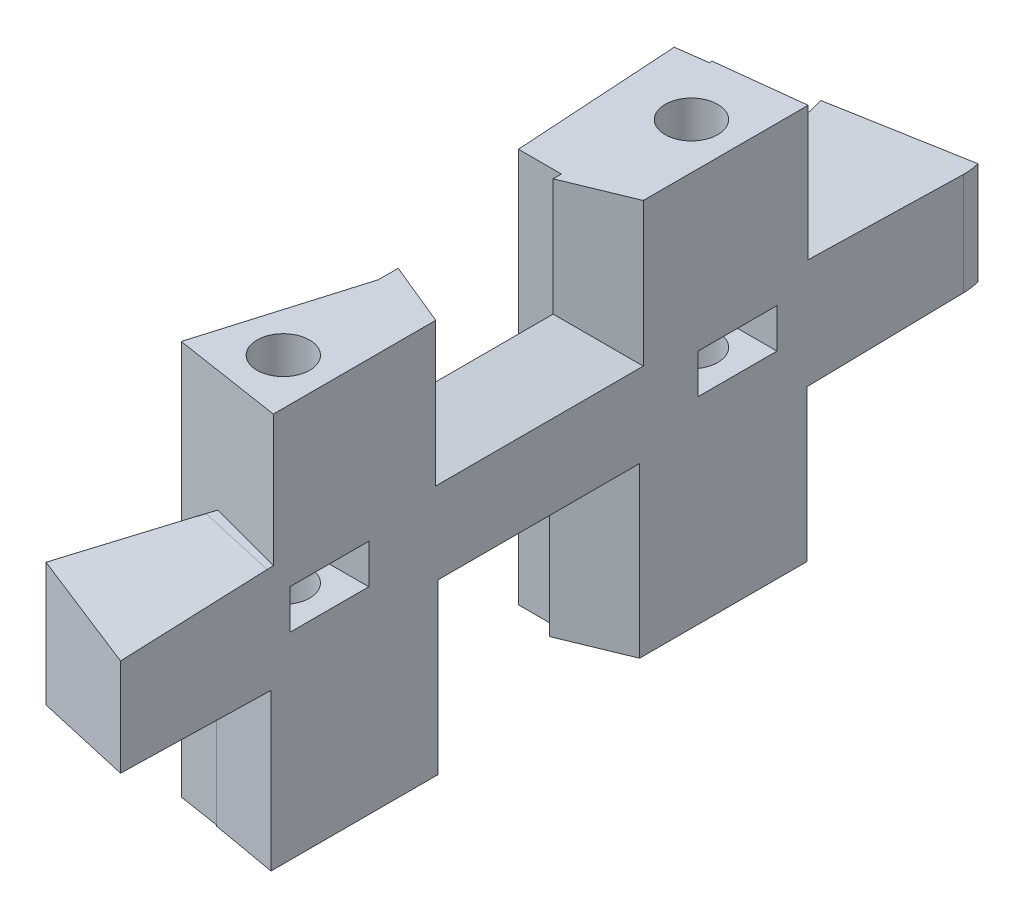
from build123d import *

# Parameters (mm, degrees)
SKETCH_2_W               = 27
SKETCH_2_H               = 75
EXTRUDE_1_DEPTH          = 30
FILLET_1_R               = 5
CUT_EXTRUDE_1_DEPTH      = 10
CUT_EXTRUDE_1_DEPTH_BACK = 62.976777909
SKETCH_3_W               = 12.003584996
SKETCH_3_H               = 8.623265084
SKETCH_3_W_2             = 13.38824361
SKETCH_3_H_2             = 10.855989936
CUT_EXTRUDE_2_DEPTH      = 56.093103017
CUT_EXTRUDE_2_DEPTH_BACK = 56.093103017
SKETCH_4_W               = 11.777688934
SKETCH_4_H               = 8.406294685
SKETCH_4_W_2             = 11.330835953
SKETCH_4_H_2             = 19.308390714
CUT_EXTRUDE_3_DEPTH      = 10
CUT_EXTRUDE_3_DEPTH_BACK = 62.976777909
SKETCH_5_W               = 10.454752522
SKETCH_5_H               = 7.917134022
SKETCH_5_W_2             = 10.247562273
SKETCH_5_H_2             = 14.675567582
CUT_EXTRUDE_4_DEPTH      = 51.311529494
CUT_EXTRUDE_5_DEPTH      = 1
CUT_EXTRUDE_6_DEPTH      = 56.093103188
CUT_EXTRUDE_6_DEPTH_BACK = 56.093103188
CUT_EXTRUDE_7_DEPTH      = 56.093103188
CUT_EXTRUDE_7_DEPTH_BACK = 56.093103188
SKETCH_28_R              = 2
CUT_EXTRUDE_8_DEPTH      = 53.794412747
CUT_EXTRUDE_9_DEPTH      = 51.311529658
SKETCH_30_W              = 10.059160286
SKETCH_30_H              = 37.902915959
SKETCH_30_W_2            = 15.489849721
SKETCH_30_H_2            = 38.902668553
CUT_EXTRUDE_10_DEPTH     = 51.038113138
SKETCH_31_W              = 8.737975265
SKETCH_31_H              = 34.755902135
SKETCH_31_W_2            = 10.96580713
CUT_EXTRUDE_11_DEPTH     = 49.583503796
CUT_EXTRUDE_12_DEPTH     = 50.524399755
CUT_EXTRUDE_13_DEPTH     = 48.916784232
SKETCH_35_W              = 30.266892165
SKETCH_35_H              = 64.418514712
CUT_EXTRUDE_14_DEPTH     = 49.293556396
SKETCH_36_W              = 14.582556354
SKETCH_36_H              = 32.207236855
CUT_EXTRUDE_15_DEPTH     = 49.026638847
CUT_EXTRUDE_16_DEPTH     = 47.743690696
CUT_EXTRUDE_17_DEPTH     = 47.743690696
CUT_EXTRUDE_19_DEPTH     = 9.2
CUT_EXTRUDE_20_REACH     = 64.237
CUT_EXTRUDE_21_REACH     = 48.744
SKETCH_41_W              = 6
SKETCH_41_H              = 3


with BuildPart() as part:
    # 草图2 → 凸台-拉伸1 (new body)
    with BuildSketch(Plane(origin=(0, 0, 0), x_dir=(1, 0, 0), z_dir=(0, 1, 0))):
        with Locations((-1.5, 0)):
            Rectangle(SKETCH_2_W, SKETCH_2_H)
    extrude(amount=EXTRUDE_1_DEPTH)

    # 圆角1
    fillet_1_edges = [part.edges().sort_by_distance(p)[0] for p in [
        (12, 15, -37.5),
        (12, 15, 37.5),
    ]]
    fillet(fillet_1_edges, radius=FILLET_1_R)

    # 草图3 → 切除-拉伸1 (cut, two sides: drawn at the far end of the back side and taken through both)
    with BuildSketch(Plane(origin=(18.680874692, 0, -5.005525288), x_dir=(-0.2588190451025125, 0, -0.9659258262890705), z_dir=(0.9659258262890705, 0, -0.2588190451025125)).offset(-CUT_EXTRUDE_1_DEPTH_BACK)):
        with Locations((24.234815862, 24.978507534)):
            Rectangle(SKETCH_3_W, SKETCH_3_H)
        with Locations((24.671178169, 5.427994968)):
            Rectangle(SKETCH_3_W_2, SKETCH_3_H_2)
    extrude(amount=CUT_EXTRUDE_1_DEPTH + CUT_EXTRUDE_1_DEPTH_BACK, mode=Mode.SUBTRACT)

    # 草图4 → 切除-拉伸2 (cut, two sides: drawn at the far end of the back side and taken through both)
    with BuildSketch(Plane(origin=(12, 0, 0), x_dir=(0, 0, -1), z_dir=(1, 0, 0)).offset(-CUT_EXTRUDE_2_DEPTH_BACK)):
        with Locations((0.274688021, 25.296852658)):
            Rectangle(SKETCH_4_W, SKETCH_4_H)
        with Locations((0.220425577, 1.167429902)):
            Rectangle(SKETCH_4_W_2, SKETCH_4_H_2)
    extrude(amount=CUT_EXTRUDE_2_DEPTH + CUT_EXTRUDE_2_DEPTH_BACK, mode=Mode.SUBTRACT)

    # 草图5 → 切除-拉伸3 (cut, two sides: drawn at the far end of the back side and taken through both)
    with BuildSketch(Plane(origin=(18.680874692, 0, 5.005525288), x_dir=(0.25881904510251236, 0, -0.9659258262890705), z_dir=(0.9659258262890706, 0, 0.25881904510251236)).offset(-CUT_EXTRUDE_3_DEPTH_BACK)):
        with Locations((-23.173403852, 25.272433697)):
            Rectangle(SKETCH_5_W, SKETCH_5_H)
        with Locations((-23.069808728, 2.959186052)):
            Rectangle(SKETCH_5_W_2, SKETCH_5_H_2)
    extrude(amount=CUT_EXTRUDE_3_DEPTH + CUT_EXTRUDE_3_DEPTH_BACK, mode=Mode.SUBTRACT)

    # 草图6 → 切除-拉伸4 (cut, through all)
    with BuildSketch(Plane.XZ):
        Polygon((7.146107594, 7.129038799), (3.725036618, 18.666143782), (-0.059848724, 31.430164127), (-15, 28.234595706), (-15, -49.974737356), (-6.027187149, -52.37103324), (-0.374019248, -31.203022256), (3.096542815, -19.264972049), (3.878697096, -6.795389704), (7.146107594, -6.795389704), align=None)
    extrude(amount=-CUT_EXTRUDE_4_DEPTH, mode=Mode.SUBTRACT)

    # 草图9 → 切除-放样2 section 0
    with BuildSketch(Plane(origin=(20.612726345, 0, -5.523163378), x_dir=(-0.2588190451025125, 0, -0.9659258262890705), z_dir=(0.9659258262890705, 0, -0.2588190451025125))):
        with BuildLine():
            Line((30.994329497, 19.422837815), (16.233023364, 19.422837815))
            Line((16.233023364, 19.422837815), (16.233023364, 30))
            Line((16.233023364, 30), (30.994329497, 30))
            Line((30.994329497, 30), (30.994329497, 19.422837815))
        make_face()
    # 草图8 → 切除-放样2 section 1
    with BuildSketch(Plane(origin=(8.019388794, 0, -2.331351103), x_dir=(-0.27915709503779457, 0, -0.9602454458574953), z_dir=(0.9602454458574953, 0, -0.27915709503779457))):
        with BuildLine():
            Line((30.066970145, 29.290140076), (18.060708335, 29.290140076))
            Line((18.060708335, 29.290140076), (18.060708335, 20.666874992))
            Line((18.060708335, 20.666874992), (30.066970145, 20.666874992))
            Line((30.066970145, 20.666874992), (30.066970145, 29.290140076))
        make_face()
    loft(mode=Mode.SUBTRACT)

    # 草图12 → 切除-放样4 section 0
    with BuildSketch(Plane(origin=(8.019388794, 0, -2.331351103), x_dir=(-0.27915709503779457, 0, -0.9602454458574953), z_dir=(0.9602454458574953, 0, -0.27915709503779457))):
        with BuildLine():
            Line((31.19539038, 0), (31.19539038, 10.855989936))
            Line((31.19539038, 10.855989936), (30.066970145, 10.855989936))
            Line((30.066970145, 10.855989936), (17.804684254, 10.855989936))
            Line((17.804684254, 10.855989936), (17.804684254, 0))
            Line((17.804684254, 0), (31.19539038, 0))
        make_face()
    # 草图11 → 切除-放样4 section 1
    with BuildSketch(Plane(origin=(20.612726345, 0, -5.523163378), x_dir=(-0.2588190451025125, 0, -0.9659258262890705), z_dir=(0.9659258262890705, 0, -0.2588190451025125))):
        with BuildLine():
            Line((16.233023364, 11.839832351), (31.553216936, 11.839832351))
            Line((31.553216936, 11.839832351), (31.553216936, 0))
            Line((31.553216936, 0), (16.233023364, 0))
            Line((16.233023364, 0), (16.233023364, 11.839832351))
        make_face()
    loft(mode=Mode.SUBTRACT)

    # 草图16 → 切除-放样5 section 0
    with BuildSketch(Plane(origin=(12, 0, 0), x_dir=(0, 0, -1), z_dir=(1, 0, 0))):
        with BuildLine():
            Line((-7.444992399, 12.821625259), (7.885843554, 12.821625259))
            Line((7.885843554, 12.821625259), (7.885843554, 0))
            Line((7.885843554, 0), (-7.444992399, 0))
            Line((-7.444992399, 0), (-7.444992399, 12.821625259))
        make_face()
    # 草图15 → 切除-放样5 section 1
    with BuildSketch(Plane.ZY.offset(-7.146107594)):
        with BuildLine():
            Line((5.444992399, 0), (5.444992399, 10.821625259))
            Line((5.444992399, 10.821625259), (-5.885843554, 10.821625259))
            Line((-5.885843554, 10.821625259), (-5.885843554, 0))
            Line((-5.885843554, 0), (5.444992399, 0))
        make_face()
    loft(mode=Mode.SUBTRACT)

    # 草图18 → 切除-放样6 section 0
    with BuildSketch(Plane(origin=(12, 0, 0), x_dir=(0, 0, -1), z_dir=(1, 0, 0))):
        with BuildLine():
            Line((8.163532488, 19.093705315), (-7.614156446, 19.093705315))
            Line((-7.614156446, 19.093705315), (-7.614156446, 30))
            Line((-7.614156446, 30), (8.163532488, 30))
            Line((8.163532488, 30), (8.163532488, 19.093705315))
        make_face()
    # 草图17 → 切除-放样6 section 1
    with BuildSketch(Plane.ZY.offset(-7.146107594)):
        with BuildLine():
            Line((5.614156446, 29.5), (-6.163532488, 29.5))
            Line((-6.163532488, 29.5), (-6.163532488, 21.093705315))
            Line((-6.163532488, 21.093705315), (5.614156446, 21.093705315))
            Line((5.614156446, 21.093705315), (5.614156446, 29.5))
        make_face()
    loft(mode=Mode.SUBTRACT)

    # 草图20 → 切除-放样7 section 0
    with BuildSketch(Plane(origin=(8.511647159, 0, 2.523938986), x_dir=(-0.28429225609974595, 0, 0.9587376664769757), z_dir=(-0.9587376664769756, 0, -0.2842922560997459))):
        with BuildLine():
            Line((28.175687949, 29.231000708), (28.175687949, 21.313866686))
            Line((28.175687949, 21.313866686), (17.717272084, 21.313866686))
            Line((17.717272084, 21.313866686), (17.717272084, 29.231000708))
            Line((17.717272084, 29.231000708), (28.175687949, 29.231000708))
        make_face()
    # 草图19 → 切除-放样7 section 1
    with BuildSketch(Plane(origin=(20.612726345, 0, 5.523163378), x_dir=(0.25881904510251236, 0, -0.9659258262890705), z_dir=(0.9659258262890706, 0, 0.25881904510251236))):
        with BuildLine():
            Line((-30.400780113, 30), (-15.946027591, 30))
            Line((-15.946027591, 30), (-15.946027591, 19.313866686))
            Line((-15.946027591, 19.313866686), (-30.400780113, 19.313866686))
            Line((-30.400780113, 19.313866686), (-30.400780113, 30))
        make_face()
    loft(mode=Mode.SUBTRACT)

    # 草图23 → 切除-放样8 section 0
    with BuildSketch(Plane(origin=(8.511647159, 0, 2.523938986), x_dir=(-0.28429225609974595, 0, 0.9587376664769757), z_dir=(-0.9587376664769756, 0, -0.2842922560997459))):
        with BuildLine():
            Line((16.852369456, 0), (28.787602444, 0))
            Line((28.787602444, 0), (28.787602444, 11.157572741))
            Line((28.787602444, 11.157572741), (16.852369456, 11.157572741))
            Line((16.852369456, 11.157572741), (16.852369456, 0))
        make_face()
    # 草图21 → 切除-放样8 section 1
    with BuildSketch(Plane(origin=(20.612726345, 0, 5.523163378), x_dir=(0.25881904510251236, 0, -0.9659258262890705), z_dir=(0.9659258262890706, 0, 0.25881904510251236))):
        with BuildLine():
            Line((-30.286760813, 12.296969843), (-15.946027591, 12.296969843))
            Line((-15.946027591, 12.296969843), (-15.946027591, 0))
            Line((-15.946027591, 0), (-30.286760813, 0))
            Line((-30.286760813, 0), (-30.286760813, 12.296969843))
        make_face()
    loft(mode=Mode.SUBTRACT)

    # 草图25 → 切除-拉伸5 (cut)
    with BuildSketch(Plane(origin=(0, 30, 0), x_dir=(1, 0, 0), z_dir=(0, 1, 0))):
        with BuildLine():
            Line((0.501517264, -29.537032302), (11.625363064, -34.398951428))
            ThreePointArc((11.625363064, -34.398951428), (11.905446734, -33.46777701), (12, -32.5))
            Line((12, -32.5), (12, -20.437772986))
            Line((12, -20.437772986), (3.474763906, -19.51015508))
            Line((3.474763906, -19.51015508), (0.501517264, -29.537032302))
        make_face()
        with BuildLine():
            Line((12, 20.700973532), (2.977613921, 19.674064031))
            Line((2.977613921, 19.674064031), (-0.374019248, 31.203022256))
            Line((-0.374019248, 31.203022256), (11.306961147, 35.039701887))
            ThreePointArc((11.306961147, 35.039701887), (11.823629636, 33.816281555), (12, 32.5))
            Line((12, 32.5), (12, 20.700973532))
        make_face()
        Polygon((7.146107594, 6.163532488), (12, 8.163532488), (12, -7.614156446), (7.146107594, -5.614156446), align=None)
    extrude(amount=-CUT_EXTRUDE_5_DEPTH, mode=Mode.SUBTRACT)

    # 草图26 → 切除-拉伸6 (cut, two sides: drawn at the far end of the back side and taken through both)
    with BuildSketch(Plane(origin=(12, 0, 0), x_dir=(0, 0, -1), z_dir=(1, 0, 0)).offset(-CUT_EXTRUDE_6_DEPTH_BACK)):
        with BuildLine():
            Line((-37.5, 3.256499349), (-43.423283477, 4.717056112))
            Line((-43.423283477, 4.717056112), (-37.5, 28.189374855))
            ThreePointArc((-37.5, 28.189374855), (-35.985697907, 15.722937102), (-37.5, 3.256499349))
        make_face()
    extrude(amount=CUT_EXTRUDE_6_DEPTH + CUT_EXTRUDE_6_DEPTH_BACK, mode=Mode.SUBTRACT)

    # 草图27 → 切除-拉伸7 (cut, two sides: drawn at the far end of the back side and taken through both)
    with BuildSketch(Plane(origin=(12, 0, 0), x_dir=(0, 0, -1), z_dir=(1, 0, 0)).offset(-CUT_EXTRUDE_7_DEPTH_BACK)):
        with BuildLine():
            Line((37.5, 4.153795449), (43.060589444, 13.210819797))
            Line((43.060589444, 13.210819797), (37.5, 25.846204551))
            ThreePointArc((37.5, 25.846204551), (35.824484835, 15), (37.5, 4.153795449))
        make_face()
    extrude(amount=CUT_EXTRUDE_7_DEPTH + CUT_EXTRUDE_7_DEPTH_BACK, mode=Mode.SUBTRACT)

    # 草图28 → 切除-拉伸8 (cut, through all)
    with BuildSketch(Plane.XZ.offset(4)):
        with Locations((-10.5, 33.410449294)):
            Circle(SKETCH_28_R)
        with Locations((8.5, 15.704094532)):
            Circle(SKETCH_28_R)
        with Locations((8.5, -15.327351188)):
            Circle(SKETCH_28_R)
    extrude(amount=-CUT_EXTRUDE_8_DEPTH, mode=Mode.SUBTRACT)

    # 草图29 → 切除-拉伸9 (cut, through all)
    with BuildSketch(Plane(origin=(0, 30, 0), x_dir=(1, 0, 0), z_dir=(0, 1, 0))):
        Polygon((-0.059848724, -31.430164127), (-2.314184215, -39.032609504), (-18.769782414, -40.942420712), (-19.653149801, -21.861685155), align=None)
    extrude(amount=-CUT_EXTRUDE_9_DEPTH, mode=Mode.SUBTRACT)

    # 草图30 → 切除-拉伸10 (cut, through all)
    with BuildSketch(Plane(origin=(12, 0, 0), x_dir=(0, 0, -1), z_dir=(1, 0, 0))):
        with Locations((-40.437824351, 17.746407142)):
            Rectangle(SKETCH_30_W, SKETCH_30_H)
        with Locations((43.465090291, 13.206278768)):
            Rectangle(SKETCH_30_W_2, SKETCH_30_H_2)
    extrude(amount=-CUT_EXTRUDE_10_DEPTH, mode=Mode.SUBTRACT)

    # 草图31 → 切除-拉伸11 (cut, through all)
    with BuildSketch(Plane(origin=(12, 0, 0), x_dir=(0, 0, -1), z_dir=(1, 0, 0))):
        with Locations((-38.655263386, 17.377951067)):
            Rectangle(SKETCH_31_W, SKETCH_31_H)
        with Locations((41.058750353, 17.377951067)):
            Rectangle(SKETCH_31_W_2, SKETCH_31_H)
    extrude(amount=-CUT_EXTRUDE_11_DEPTH, mode=Mode.SUBTRACT)

    # 草图32 → 切除-拉伸12 (cut, through all)
    with BuildSketch(Plane(origin=(8.511647159, 0, 2.523938986), x_dir=(-0.28429225609974595, 0, 0.9587376664769757), z_dir=(-0.9587376664769756, 0, -0.2842922560997459))):
        with BuildLine():
            Line((33.129330241, 28), (45.117943931, 24.625279412))
            Line((45.117943931, 24.625279412), (33.129330241, 2))
            ThreePointArc((33.129330241, 2), (29.425195526, 15), (33.129330241, 28))
        make_face()
    extrude(amount=-CUT_EXTRUDE_12_DEPTH, mode=Mode.SUBTRACT)

    # 草图33 → 切除-拉伸13 (cut, through all)
    with BuildSketch(Plane(origin=(7.429248175, 0, -1.984068666), x_dir=(0.25801907586145423, 0, 0.966139822433379), z_dir=(-0.966139822433379, 0, 0.25801907586145423))):
        with BuildLine():
            Line((-34.769064831, 27), (-43.42515103, 23.964002922))
            Line((-43.42515103, 23.964002922), (-34.769064831, 3))
            ThreePointArc((-34.769064831, 3), (-31.367076602, 15), (-34.769064831, 27))
        make_face()
    extrude(amount=-CUT_EXTRUDE_13_DEPTH, mode=Mode.SUBTRACT)

    # 草图35 → 切除-拉伸14 (cut, through all)
    with BuildSketch(Plane(origin=(8.019388794, 0, -2.331351103), x_dir=(0.2791570950377951, 0, 0.960245445857495), z_dir=(-0.9602454458574952, 0, 0.2791570950377951))):
        with Locations((-44.26539168, 12.1099661)):
            Rectangle(SKETCH_35_W, SKETCH_35_H)
    extrude(amount=-CUT_EXTRUDE_14_DEPTH, mode=Mode.SUBTRACT)

    # 草图36 → 切除-拉伸15 (cut, through all)
    with BuildSketch(Plane(origin=(8.511647159, 0, 2.523938986), x_dir=(-0.28429225609974595, 0, 0.9587376664769757), z_dir=(-0.9587376664769756, 0, -0.2842922560997459))):
        with Locations((34.154155961, 16.103618428)):
            Rectangle(SKETCH_36_W, SKETCH_36_H)
    extrude(amount=-CUT_EXTRUDE_15_DEPTH, mode=Mode.SUBTRACT)

    # 草图37 → 切除-拉伸16 (cut, through all)
    with BuildSketch(Plane.XZ):
        Polygon((3.04908486, -19.428218073), (5.463167808, -19.748869392), (2.578231647, -31.0875489), (0.855497841, -35.943044952), (-10.048623229, -28.744086493), align=None)
    extrude(amount=-CUT_EXTRUDE_16_DEPTH, mode=Mode.SUBTRACT)

    # 草图38 → 切除-拉伸17 (cut, through all)
    with BuildSketch(Plane(origin=(0, 30, 0), x_dir=(1, 0, 0), z_dir=(0, 1, 0))):
        Polygon((3.943504332, -29.188365604), (6.997098327, -19.188702801), (3.720649026, -18.680940353), (-14.795599346, -29.188365604), align=None)
    extrude(amount=-CUT_EXTRUDE_17_DEPTH, mode=Mode.SUBTRACT)

    # 草图39 → 切除-拉伸19 (cut)
    with BuildSketch(Plane(origin=(0, 30, 0), x_dir=(1, 0, 0), z_dir=(0, 1, 0))):
        Polygon((6.997098327, -19.188702801), (12, -19.964019423), (12, -21.24661692), (6.623129677, -20.413345109), align=None)
    extrude(amount=-CUT_EXTRUDE_19_DEPTH, mode=Mode.SUBTRACT)

    # 切除-拉伸20: up to this plane
    cut_extrude_20_end = Plane(origin=(6.997098327, -0.0001, 19.188702801), z_dir=(0.15314527326355704, 0, -0.9882036861280322))
    # 草图40 → 切除-拉伸20 (cut, up to the surface)
    with BuildSketch(Plane(origin=(-2.057373604, 0, 18.908211655), x_dir=(0.9941324082517923, 0, 0.10817002756536495), z_dir=(-0.10817002756536495, 0, 0.9941324082517923)), mode=Mode.PRIVATE) as cut_extrude_20_sk1:
        Polygon((14.140343366, 20.8), (8.927435283, 20.8), (14.140343366, 20.003383314), align=None)
    cut_extrude_20_tool1 = split(extrude(cut_extrude_20_sk1.sketch, amount=-CUT_EXTRUDE_20_REACH, mode=Mode.PRIVATE), bisect_by=cut_extrude_20_end, keep=Keep.BOTH, mode=Mode.PRIVATE)
    add(cut_extrude_20_tool1.solids().sort_by_distance((10.27256, 20.534461, 20.249813))[0], mode=Mode.SUBTRACT)

    # 切除-拉伸21: up to this face of the body (flat: up to its plane)
    cut_extrude_21_end = Plane(part.part.faces().sort_by_distance((12, 15.17379026, -0.488369359))[0])
    # 草图41 → 切除-拉伸21 (cut, up to the picked face)
    with BuildSketch(Plane(origin=(0, 0, 0), x_dir=(0, 0, -1), z_dir=(1, 0, 0)), mode=Mode.PRIVATE) as cut_extrude_21_sk1:
        Polygon((-13.704094532, 15), (-12.704094532, 15), (-12.704094532, 18), (-18.680940353, 18), (-18.680940353, 15), align=None)
    cut_extrude_21_tool1 = split(extrude(cut_extrude_21_sk1.sketch, amount=CUT_EXTRUDE_21_REACH, mode=Mode.PRIVATE), bisect_by=cut_extrude_21_end, keep=Keep.BOTH, mode=Mode.PRIVATE)
    # 草图41 → 切除-拉伸21 (cut, up to the picked face)
    with BuildSketch(Plane(origin=(0, 0, 0), x_dir=(0, 0, -1), z_dir=(1, 0, 0)), mode=Mode.PRIVATE) as cut_extrude_21_sk2:
        with Locations((15.327351188, 16.5)):
            Rectangle(SKETCH_41_W, SKETCH_41_H)
    cut_extrude_21_tool2 = split(extrude(cut_extrude_21_sk2.sketch, amount=CUT_EXTRUDE_21_REACH, mode=Mode.PRIVATE), bisect_by=cut_extrude_21_end, keep=Keep.BOTH, mode=Mode.PRIVATE)
    add(cut_extrude_21_tool1.solids().sort_by(Axis((0, 16.5, 15.692517), (1, 0, 0)))[0], mode=Mode.SUBTRACT)
    add(cut_extrude_21_tool2.solids().sort_by(Axis((0, 16.5, -15.327351), (1, 0, 0)))[0], mode=Mode.SUBTRACT)


solid = part.part
